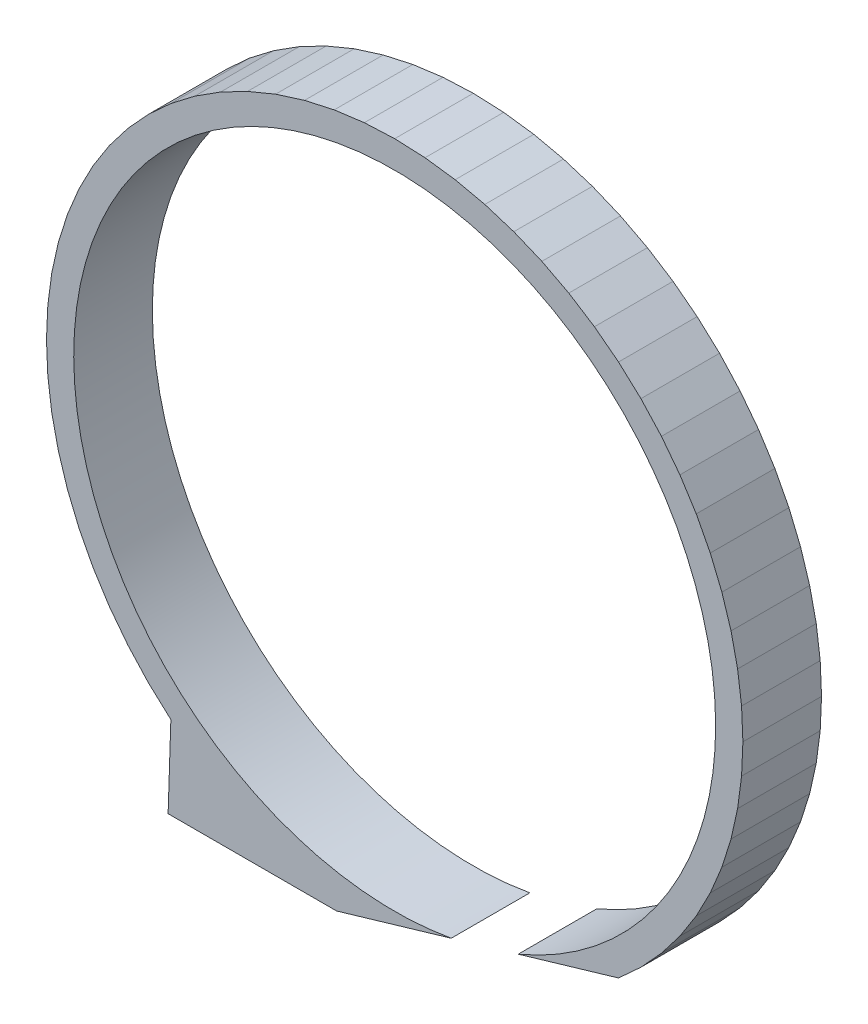
from build123d import *

# Parameters (mm, degrees)
CLAMP_AND_LOWER_FOOT_DEPTH = 14
SKETCH_2_R                 = 57.15
CANISTER_SEAT_DEPTH        = 89.973634297


with BuildPart() as part:
    # 草图1 → Clamp_and_lower_foot (new body)
    with BuildSketch(Plane.XY):
        Polygon((39.852831801, -47.494755473), (43.840620434, -43.840620434), (47.494755473, -39.852831801), (50.787426746, -35.561739054), (53.693575035, -31), (56.191082796, -26.202332228), (58.260942489, -21.205248886), (59.88740123, -16.046780796), (61.058080687, -10.766187015), (61.764071282, -5.40365605), (62, 0), (61.764071282, 5.40365605), (61.058080687, 10.766187015), (59.88740123, 16.046780796), (58.260942489, 21.205248886), (56.191082796, 26.202332228), (53.693575035, 31), (50.787426746, 35.561739054), (47.494755473, 39.852831801), (43.840620434, 43.840620434), (39.852831801, 47.494755473), (35.561739054, 50.787426746), (31, 53.693575035), (26.202332228, 56.191082796), (21.205248886, 58.260942489), (16.046780796, 59.88740123), (10.766187015, 61.058080687), (5.40365605, 61.764071282), (0, 62), (-5.40365605, 61.764071282), (-10.766187015, 61.058080687), (-16.046780796, 59.88740123), (-21.205248886, 58.260942489), (-26.202332228, 56.191082796), (-31, 53.693575035), (-35.561739054, 50.787426746), (-39.852831801, 47.494755473), (-43.840620434, 43.840620434), (-47.494755473, 39.852831801), (-50.787426746, 35.561739054), (-53.693575035, 31), (-56.191082796, 26.202332228), (-58.260942489, 21.205248886), (-59.88740123, 16.046780796), (-61.058080687, 10.766187015), (-61.764071282, 5.40365605), (-62, 0), (-61.764071282, -5.40365605), (-61.058080687, -10.766187015), (-59.88740123, -16.046780796), (-58.260942489, -21.205248886), (-56.191082796, -26.202332228), (-53.693575035, -31), (-50.787426746, -35.561739054), (-47.494755473, -39.852831801), (-43.840620434, -43.840620434), (-39.852831801, -47.494755473), (-40.3415, -62.26), (-10.3415, -62.26), align=None)
    extrude(amount=CLAMP_AND_LOWER_FOOT_DEPTH)

    # 草图2 → Canister_seat (cut, through all)
    with BuildSketch(Plane.XY.offset(14)):
        Circle(SKETCH_2_R)
    extrude(amount=-CANISTER_SEAT_DEPTH, mode=Mode.SUBTRACT)


solid = part.part
